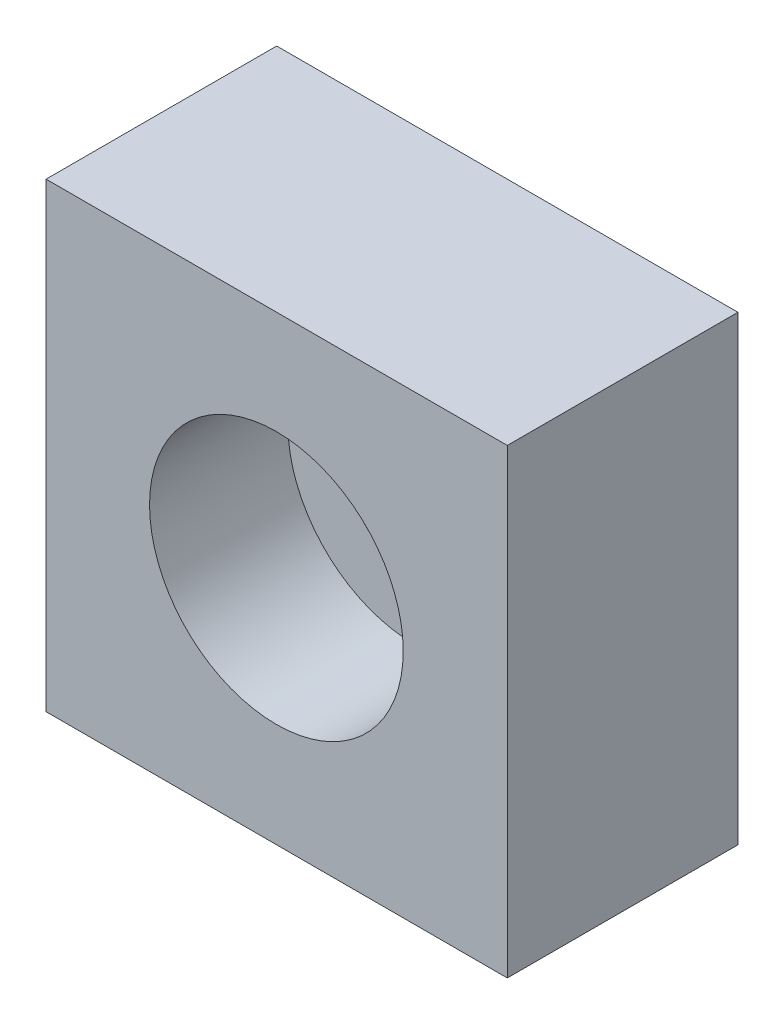
from build123d import *

# Parameters (mm, degrees)
SKETCH_1_W                           = 20
SKETCH_1_H                           = 20
BASEBOX_DEPTH                        = 10
HOLE_CB_ISO_SOCKETCAP_M6_D           = 6
HOLE_CB_ISO_SOCKETCAP_M6_CBORE_D     = 11
HOLE_CB_ISO_SOCKETCAP_M6_CBORE_DEPTH = 6


with BuildPart() as part:
    # 草图1 → BaseBox (new body)
    with BuildSketch(Plane.XY):
        with Locations((10, 10)):
            Rectangle(SKETCH_1_W, SKETCH_1_H)
    extrude(amount=BASEBOX_DEPTH)

    # Hole_cb_iso_socketcap_m6 (through all)
    with Locations(Plane.XY.offset(10)):
        with Locations((9.986487375, 10.014305599)):
            CounterBoreHole(HOLE_CB_ISO_SOCKETCAP_M6_D / 2, HOLE_CB_ISO_SOCKETCAP_M6_CBORE_D / 2, HOLE_CB_ISO_SOCKETCAP_M6_CBORE_DEPTH)


solid = part.part
